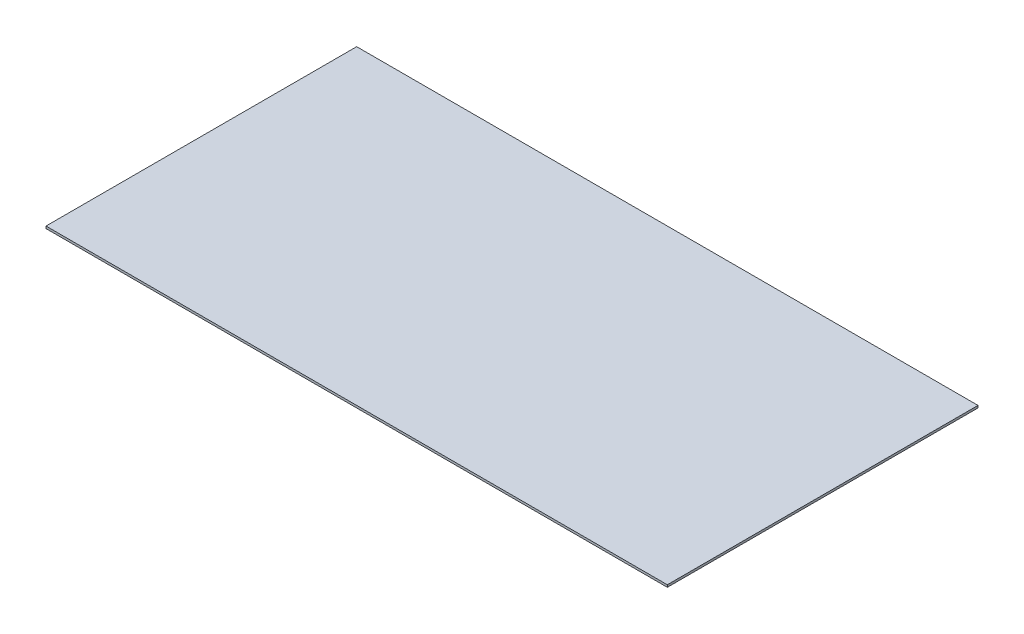
from build123d import *

# Parameters (mm, degrees)
SKETCH_1_W      = 2500
SKETCH_1_H      = 1250
EXTRUDE_1_DEPTH = 9


with BuildPart() as part:
    # Эскиз1 → Бобышка-Вытянуть1 (new body)
    with BuildSketch(Plane(origin=(0, 0, 0), x_dir=(1, 0, 0), z_dir=(0, 1, 0))):
        Rectangle(SKETCH_1_W, SKETCH_1_H)
    extrude(amount=EXTRUDE_1_DEPTH)


solid = part.part
